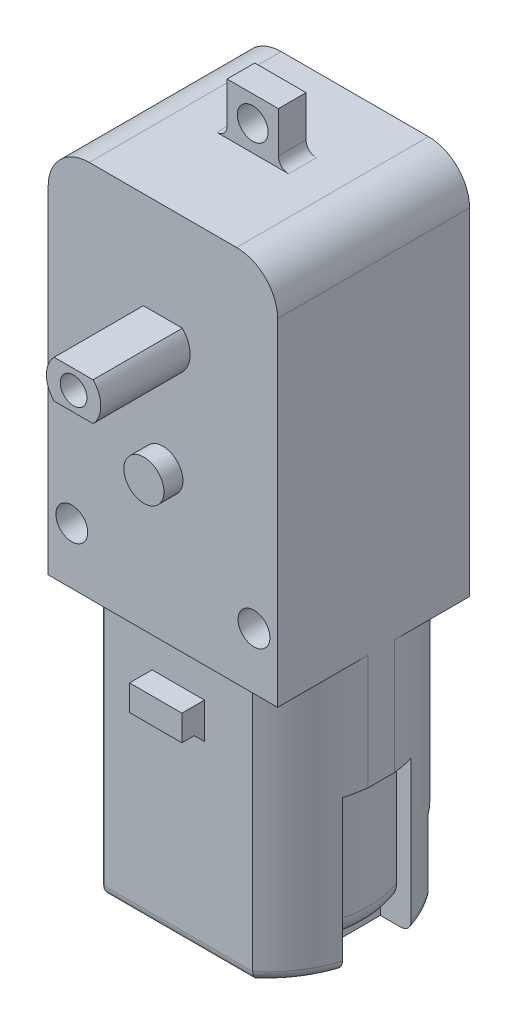
from build123d import *

# Parameters (mm, degrees)
BOSS_EXTRUDE1_DEPTH      = 10.1
BOSS_EXTRUDE1_DEPTH_BACK = 8.6
SKETCH1_R                = 1.55
BOSS_EXTRUDE2_DEPTH      = 8.7
SKETCH3_R                = 1.95
BOSS_EXTRUDE3_DEPTH      = 1.85
BOSS_EXTRUDE4_DEPTH      = 26
SKETCH5_W                = 5.1
SKETCH5_H                = 2.5
BOSS_EXTRUDE5_DEPTH      = 2.2
CHAMFER1_SIZE            = 1
CUT_EXTRUDE1_DEPTH       = 14.8
SKETCH7_W                = 3
SKETCH7_H                = 6.7
CUT_EXTRUDE2_DEPTH       = 1.5
FILLET1_R                = 2
SKETCH8_W                = 7.6
SKETCH8_H                = 8.5
BOSS_EXTRUDE6_DEPTH      = 1.5
SKETCH9_W                = 6.939646177
SKETCH9_H                = 7.5
CUT_EXTRUDE3_DEPTH       = 2
SKETCH10_W               = 3.7
SKETCH10_H               = 2
BOSS_EXTRUDE7_DEPTH      = 1
FILLET2_R                = 1.5
BOSS_EXTRUDE8_DEPTH      = 1
SKETCH12_R               = 1
BOSS_EXTRUDE9_DEPTH      = 1
SKETCH13_R               = 1.3
CUT_EXTRUDE4_DEPTH       = 8.7
SKETCH14_W               = 5
SKETCH14_H               = 5
SKETCH14_R               = 1.5
BOSS_EXTRUDE10_DEPTH     = 1.35
FILLET3_R                = 1


with BuildPart() as part:
    # Sketch1 → Boss-Extrude1 (new, two sides: drawn at the far end of the back side and taken through both)
    with BuildSketch(Plane.XY.offset(-BOSS_EXTRUDE1_DEPTH_BACK)):
        with BuildLine():
            Line((-11.175, -25.5), (11.175, -25.5))
            Line((11.175, -25.5), (11.175, 7.3))
            ThreePointArc((11.175, 7.3), (10.003427125, 10.128427125), (7.175, 11.3))
            Line((7.175, 11.3), (-7.175, 11.3))
            ThreePointArc((-7.175, 11.3), (-10.003427125, 10.128427125), (-11.175, 7.3))
            Line((-11.175, 7.3), (-11.175, -25.5))
        make_face()
        with Locations((-8.875, -20)):
            Circle(SKETCH1_R, mode=Mode.SUBTRACT)
        with Locations(Location((8.875, -20, 0), (0, 0, 180))):
            Circle(SKETCH1_R, mode=Mode.SUBTRACT)
    extrude(amount=BOSS_EXTRUDE1_DEPTH + BOSS_EXTRUDE1_DEPTH_BACK)

    # Sketch2 → Boss-Extrude2 (add)
    with BuildSketch(Plane.XY.offset(10.1)):
        with BuildLine():
            Line((-1.897366596, 1.85), (1.897366596, 1.85))
            ThreePointArc((1.897366596, 1.85), (2.65, 0), (1.897366596, -1.85))
            Line((1.897366596, -1.85), (-1.897366596, -1.85))
            ThreePointArc((-1.897366596, -1.85), (-2.65, 0), (-1.897366596, 1.85))
        make_face()
    extrude(amount=BOSS_EXTRUDE2_DEPTH)

    # Sketch3 → Boss-Extrude3 (add)
    with BuildSketch(Plane.XY.offset(10.1)):
        with Locations(Location((0, -11, 0), (0, 0, 180))):
            Circle(SKETCH3_R)
    extrude(amount=BOSS_EXTRUDE3_DEPTH)

    # Sketch4 → Boss-Extrude4 (add)
    with BuildSketch(Plane.XZ.offset(25.5)):
        with BuildLine():
            Line((-7.252758096, -8.6), (7.252758096, -8.6))
            ThreePointArc((7.252758096, -8.6), (9.911079132, -5.322876144), (11.175, -1.296871235))
            Line((11.175, -1.296871235), (11.175, 1.296871235))
            ThreePointArc((11.175, 1.296871235), (9.911079132, 5.322876144), (7.252758096, 8.6))
            Line((7.252758096, 8.6), (-7.252758096, 8.6))
            ThreePointArc((-7.252758096, 8.6), (-9.911079132, 5.322876144), (-11.175, 1.296871235))
            Line((-11.175, 1.296871235), (-11.175, -1.296871235))
            ThreePointArc((-11.175, -1.296871235), (-9.911079132, -5.322876144), (-7.252758096, -8.6))
        make_face()
    extrude(amount=BOSS_EXTRUDE4_DEPTH)

    # Sketch5 → Boss-Extrude5 (add)
    with BuildSketch(Plane(origin=(0, 0, -8.6), x_dir=(-1, 0, 0), z_dir=(0, 0, -1))):
        with Locations((0, -31.2)):
            Rectangle(SKETCH5_W, SKETCH5_H)
    boss_extrude5 = extrude(amount=BOSS_EXTRUDE5_DEPTH)

    # Mirror1: Boss-Extrude5 across plane
    add(boss_extrude5.mirror(Plane.XY))

    # Chamfer1
    chamfer1_edges = [part.edges().sort_by_distance(p)[0] for p in [
        (0, -32.45, 8.6),
        (0, -32.45, -8.6),
    ]]
    chamfer(chamfer1_edges, length=CHAMFER1_SIZE)

    # Sketch6 → Cut-Extrude1 (cut)
    with BuildSketch(Plane.XZ.offset(51.5)):
        with BuildLine():
            Line((-11.175, 3.35), (-9.315980893, 3.35))
            ThreePointArc((-9.315980893, 3.35), (-9.9, 0), (-9.315980893, -3.35))
            Line((-9.315980893, -3.35), (-11.175, -3.35))
            Line((-11.175, -3.35), (-11.175, 3.35))
        make_face()
        with BuildLine():
            Line((11.175, -3.35), (9.315980893, -3.35))
            ThreePointArc((9.315980893, -3.35), (9.9, 0), (9.315980893, 3.35))
            Line((9.315980893, 3.35), (11.175, 3.35))
            Line((11.175, 3.35), (11.175, -3.35))
        make_face()
    extrude(amount=-CUT_EXTRUDE1_DEPTH, mode=Mode.SUBTRACT)

    # Sketch7 → Cut-Extrude2 (cut)
    with BuildSketch(Plane.XZ.offset(51.5)):
        with Locations((-9.239646177, 0)):
            Rectangle(SKETCH7_W, SKETCH7_H)
        with Locations((9.239646177, 0)):
            Rectangle(SKETCH7_W, SKETCH7_H)
    extrude(amount=-CUT_EXTRUDE2_DEPTH, mode=Mode.SUBTRACT)

    # Fillet1
    fillet1_edges = [part.edges().sort_by_distance(p)[0] for p in [
        (9.9, -50, 0),
        (-9.9, -50, 0),
    ]]
    fillet(fillet1_edges, radius=FILLET1_R)

    # Sketch8 → Boss-Extrude6 (add)
    with BuildSketch(Plane(origin=(0, 0, -8.6), x_dir=(-1, 0, 0), z_dir=(0, 0, -1))):
        with Locations((0, -47.25)):
            Rectangle(SKETCH8_W, SKETCH8_H)
    extrude(amount=BOSS_EXTRUDE6_DEPTH)

    # Sketch9 → Cut-Extrude3 (cut)
    with BuildSketch(Plane(origin=(0, 0, -8.6), x_dir=(-1, 0, 0), z_dir=(0, 0, -1))):
        with Locations((7.269823089, -47.75)):
            Rectangle(SKETCH9_W, SKETCH9_H)
        with Locations((-7.269823089, -47.75)):
            Rectangle(SKETCH9_W, SKETCH9_H)
    extrude(amount=-CUT_EXTRUDE3_DEPTH, mode=Mode.SUBTRACT)

    # Sketch10 → Boss-Extrude7 (add)
    with BuildSketch(Plane(origin=(0, 0, -6.6), x_dir=(-1, 0, 0), z_dir=(0, 0, -1))):
        with Locations((-5.65, -47.5)):
            Rectangle(SKETCH10_W, SKETCH10_H)
        with Locations((5.65, -47.5)):
            Rectangle(SKETCH10_W, SKETCH10_H)
    extrude(amount=BOSS_EXTRUDE7_DEPTH)

    # Fillet2
    fillet2_edges = [part.edges().sort_by_distance(p)[0] for p in [
        (0, -51.5, -10.1),
    ]]
    fillet(fillet2_edges, radius=FILLET2_R)

    # Sketch11 → Boss-Extrude8 (add)
    with BuildSketch(Plane.XZ.offset(51.5)):
        with BuildLine():
            Line((-2.523885893, 4.2), (2.523885893, 4.2))
            ThreePointArc((2.523885893, 4.2), (0, -4.9), (-2.523885893, 4.2))
        make_face()
    extrude(amount=BOSS_EXTRUDE8_DEPTH)

    # Sketch12 → Boss-Extrude9 (add)
    with BuildSketch(Plane.XZ.offset(52.5)):
        with Locations(Location((0, 0, 0), (0, 0, 270))):
            Circle(SKETCH12_R)
    extrude(amount=BOSS_EXTRUDE9_DEPTH)

    # Sketch13 → Cut-Extrude4 (cut)
    with BuildSketch(Plane.XY.offset(18.8)):
        Circle(SKETCH13_R)
    extrude(amount=-CUT_EXTRUDE4_DEPTH, mode=Mode.SUBTRACT)

    # Sketch14 → Boss-Extrude10 (add, symmetric)
    with BuildSketch(Plane.XY):
        with Locations((0, 13.8)):
            Rectangle(SKETCH14_W, SKETCH14_H)
        with Locations(Location((0, 13.8, 0), (0, 0, 180))):
            Circle(SKETCH14_R, mode=Mode.SUBTRACT)
    extrude(amount=BOSS_EXTRUDE10_DEPTH, both=True)

    # Fillet3
    fillet3_edges = [part.edges().sort_by_distance(p)[0] for p in [
        (9.371354111, -51.5, 6.224164371),
        (-10.057256253, -51.5, -5.041239595),
        (0, -43, -10.1),
        (10.057256253, -51.5, -5.041239595),
        (2.5, 11.3, 0),
        (-2.5, 11.3, 0),
        (0, -51.5, 8.6),
        (-9.371354111, -51.5, 6.224164371),
    ]]
    fillet(fillet3_edges, radius=FILLET3_R)


solid = part.part
